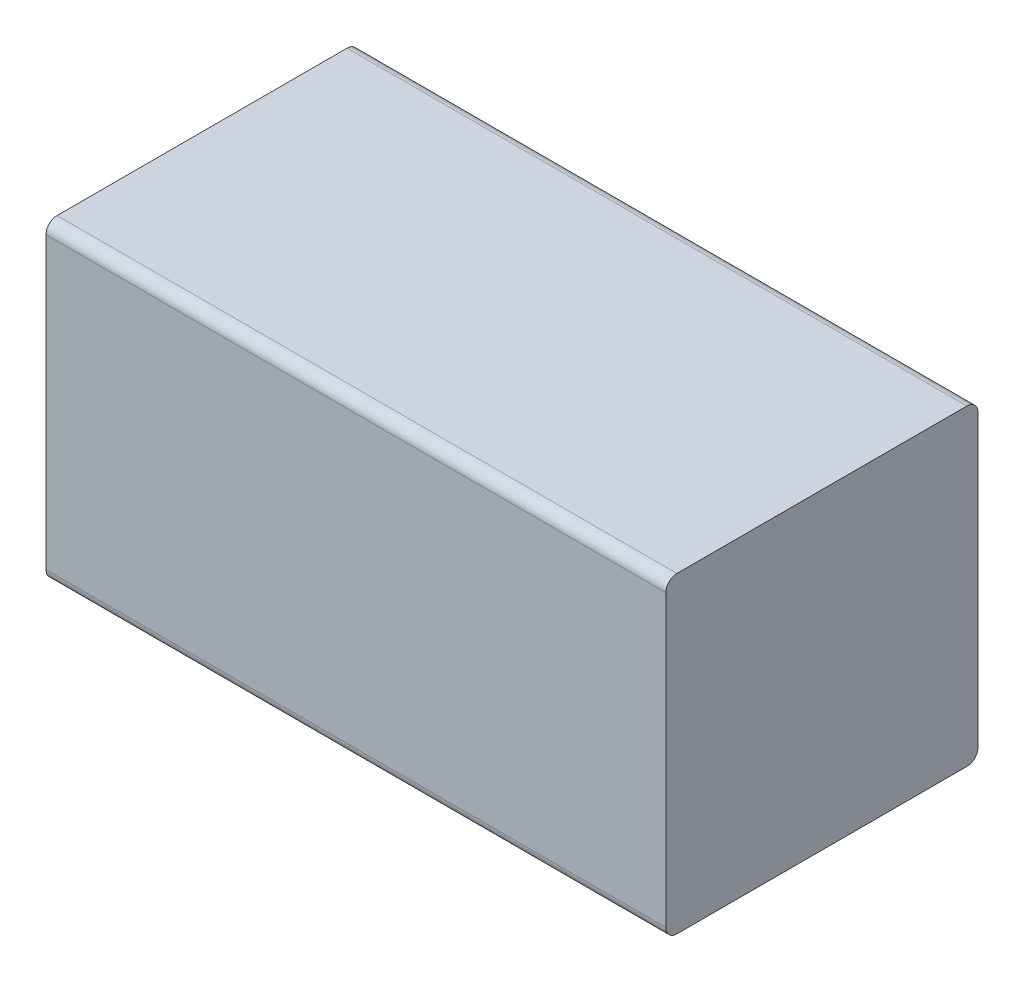
from build123d import *

# Parameters (mm, degrees)
SKETCH1_W                    = 112
SKETCH1_H                    = 56.4
BOSS_EXTRUDE1_DEPTH          = 56.4
FILLET1_R                    = 2
SKETCH2_R                    = 4
BOSS_EXTRUDE2_DEPTH          = 20.6
F_5_0_5_DIAMETER_HOLE1_D     = 5
F_5_0_5_DIAMETER_HOLE1_DEPTH = 16


with BuildPart() as part:
    # Sketch1 → Boss-Extrude1 (new body)
    with BuildSketch(Plane(origin=(0, 0, 0), x_dir=(1, 0, 0), z_dir=(0, 1, 0))):
        Rectangle(SKETCH1_W, SKETCH1_H)
    extrude(amount=BOSS_EXTRUDE1_DEPTH)

    # Fillet1
    fillet1_edges = [part.edges().sort_by_distance(p)[0] for p in [
        (0, 56.4, 28.2),
        (0, 56.4, -28.2),
        (0, 0, -28.2),
        (0, 0, 28.2),
    ]]
    fillet(fillet1_edges, radius=FILLET1_R)

    # Sketch2 → Boss-Extrude2 (add)
    with BuildSketch(Plane.ZY.offset(56)):
        with Locations((0, 28.2)):
            Circle(SKETCH2_R)
    extrude(amount=BOSS_EXTRUDE2_DEPTH)

    # Ø5.0 (5) Diameter Hole1
    with Locations(Plane.ZY.offset(56)):
        with Locations((-23.5, 51.7), (23.5, 51.7), (23.501841312, 4.700000036), (-23.498158688, 4.700000036)):
            Hole(F_5_0_5_DIAMETER_HOLE1_D / 2, depth=F_5_0_5_DIAMETER_HOLE1_DEPTH)


solid = part.part
